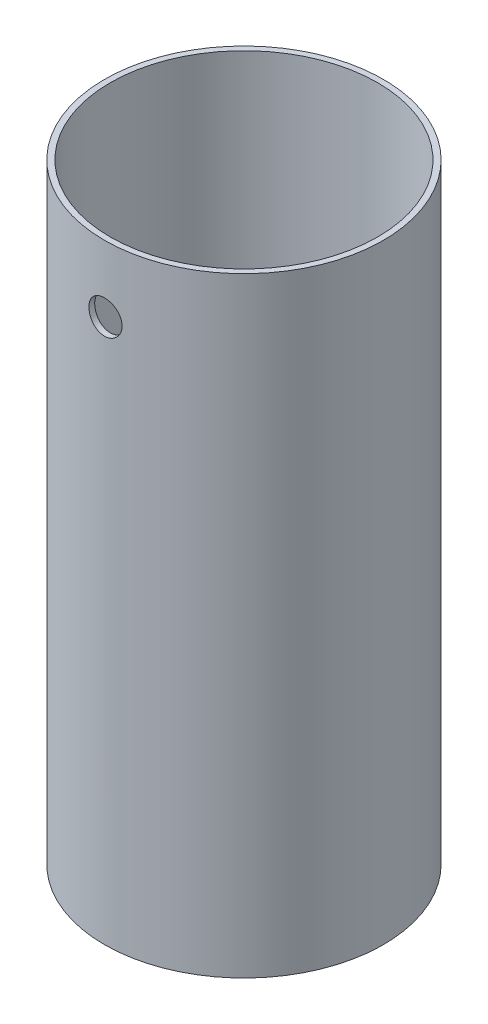
from build123d import *

# Parameters (mm, degrees)
CROQUIS2_R              = 80
CROQUIS2_R_2            = 76.7
SALIENTE_EXTRUIR1_DEPTH = 350
CROQUIS3_R              = 9.525
CORTAR_EXTRUIR1_DEPTH   = 368.831483155


with BuildPart() as part:
    # Croquis2 → Saliente-Extruir1 (new body)
    with BuildSketch(Plane(origin=(0, 0, 0), x_dir=(1, 0, 0), z_dir=(0, 1, 0))):
        with Locations(Location((0, 0, 0), (0, 0, 270))):
            Circle(CROQUIS2_R)
        with Locations(Location((0, 0, 0), (0, 0, 270))):
            Circle(CROQUIS2_R_2, mode=Mode.SUBTRACT)
    extrude(amount=-SALIENTE_EXTRUIR1_DEPTH)

    # Croquis3 → Cortar-Extruir1 (cut, through all)
    with BuildSketch(Plane.XY):
        with Locations(Location((0, -38.1, 0), (0, 0, 90))):
            Circle(CROQUIS3_R)
    extrude(amount=CORTAR_EXTRUIR1_DEPTH, mode=Mode.SUBTRACT)


solid = part.part
